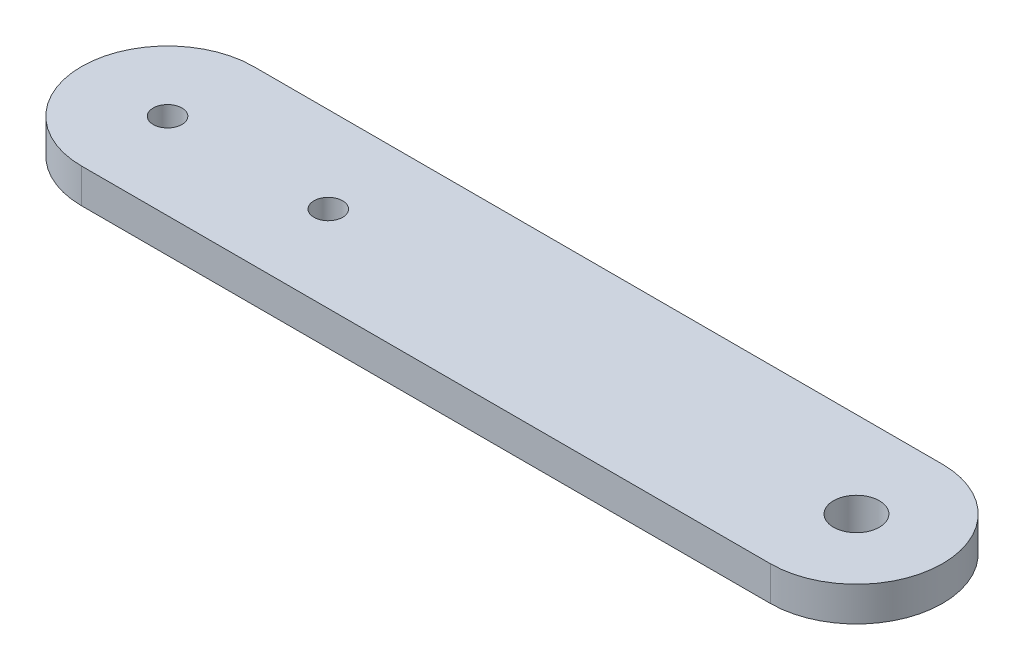
from build123d import *

# Parameters (mm, degrees)
SKETCH1_R           = 2
SKETCH1_R_2         = 1.25
BOSS_EXTRUDE1_DEPTH = 3


with BuildPart() as part:
    # Sketch1 → Boss-Extrude1 (new body)
    with BuildSketch(Plane(origin=(0, 0, 0), x_dir=(1, 0, 0), z_dir=(0, 1, 0))):
        with BuildLine():
            Line((0, 7.5), (60, 7.5))
            ThreePointArc((60, 7.5), (67.5, 0), (60, -7.5))
            Line((60, -7.5), (0, -7.5))
            ThreePointArc((0, -7.5), (-7.5, 0), (0, 7.5))
        make_face()
        with Locations(Location((60, 0, 0), (0, 0, 270))):
            Circle(SKETCH1_R, mode=Mode.SUBTRACT)
        with Locations(Location((0, 0, 0), (0, 0, 270))):
            Circle(SKETCH1_R_2, mode=Mode.SUBTRACT)
        with Locations(Location((14, 0, 0), (0, 0, 270))):
            Circle(SKETCH1_R_2, mode=Mode.SUBTRACT)
    extrude(amount=BOSS_EXTRUDE1_DEPTH)


solid = part.part
